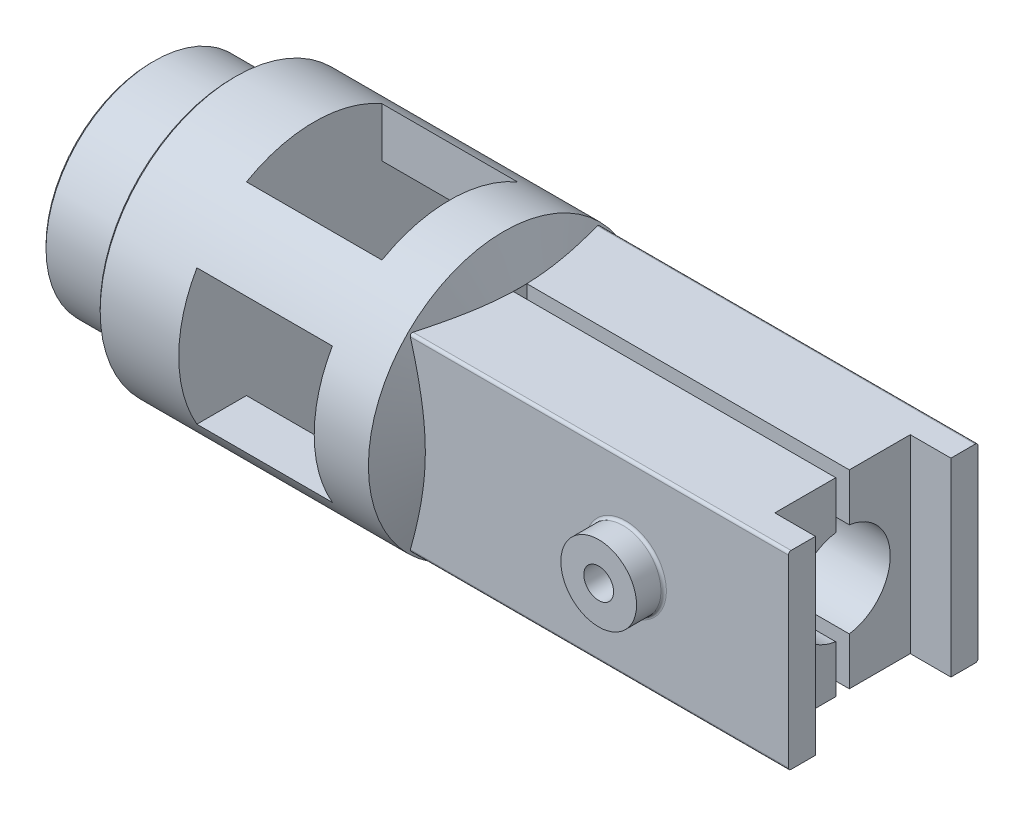
from build123d import *

# Parameters (mm, degrees)
SKETCH_1_W          = 3
SKETCH_1_H          = 4
SKETCH_2_W          = 8.891252249
SKETCH_2_H          = 5
SKETCH_2_W_2        = 5
SKETCH_2_H_2        = 11.708042321
CUT_EXTRUDE_1_DEPTH = 5
EXTRUDE_1_REACH     = 29.911
SKETCH_3_W          = 7
SKETCH_3_H          = 7
SKETCH_4_W          = 5
SKETCH_4_H          = 7
CUT_EXTRUDE_2_DEPTH = 1.5
SKETCH_5_R          = 1.761378247
SKETCH_5_W          = 0.5
SKETCH_5_H          = 7
CUT_EXTRUDE_3_DEPTH = 11.9
SKETCH_6_R          = 1.396648932
EXTRUDE_2_DEPTH     = 1
SKETCH_7_R          = 0.55
CUT_EXTRUDE_4_DEPTH = 30.055980452
CHAMFER_1_SIZE      = 0.5
FILLET_1_R          = 0.1
CHAMFER_2_SIZE      = 0.1
FILLET_2_R          = 0.1
SKETCH_8_R          = 2
CUT_EXTRUDE_5_DEPTH = 5
CHAMFER_3_SIZE      = 0.5


with BuildPart() as part:
    # 草图1 → 旋转1 (revolve)
    with BuildSketch(Plane.XY, mode=Mode.PRIVATE) as revolve_1_sk:
        with Locations((1.5, 2)):
            Rectangle(SKETCH_1_W, SKETCH_1_H)
        Polygon((3, 0), (13, 0), (13, 5), (3, 5), (3, 4), align=None)
        Polygon((13, 0), (13, 5), (15, 0), align=None)
    revolve(revolve_1_sk.sketch.rotate(Axis((3, 0, 0), (1, 0, 0)), 90), axis=Axis((3, 0, 0), (1, 0, 0)))

    # 草图2 → 切除-拉伸1 (cut)
    with BuildSketch(Plane.ZY.offset(-6)):
        with Locations((6.945626125, 0)):
            Rectangle(SKETCH_2_W, SKETCH_2_H)
        with Locations((0, -8.354021161)):
            Rectangle(SKETCH_2_W_2, SKETCH_2_H_2)
        with Locations((0, 8.354021161)):
            Rectangle(SKETCH_2_W_2, SKETCH_2_H_2)
        with Locations((-6.945626125, 0)):
            Rectangle(SKETCH_2_W, SKETCH_2_H)
        Rectangle(SKETCH_2_W_2, SKETCH_2_H)
    extrude(amount=-CUT_EXTRUDE_1_DEPTH, mode=Mode.SUBTRACT)

    # 凸台-拉伸1: up to this cone (the profile starts outside it)
    extrude_1_end = Plane(origin=(27, 0, 0), z_dir=(-1, 0, 0)).offset(12.000001) * Cone(2.5e-06, 46.0275, 18.410999, align=(Align.CENTER, Align.CENTER, Align.MIN), mode=Mode.PRIVATE)
    # 草图3 → 凸台-拉伸1 (add, up to the surface)
    with BuildSketch(Plane.ZY.offset(-27), mode=Mode.PRIVATE) as extrude_1_sk1:
        Rectangle(SKETCH_3_W, SKETCH_3_H)
    extrude_1_tool1 = extrude(extrude_1_sk1.sketch, amount=EXTRUDE_1_REACH, mode=Mode.PRIVATE) - extrude_1_end
    add(extrude_1_tool1.solids().sort_by_distance((27, 0, 0))[0])

    # 草图4 → 切除-拉伸2 (cut)
    with BuildSketch(Plane(origin=(27, 0, 0), x_dir=(0, 0, -1), z_dir=(1, 0, 0))):
        Rectangle(SKETCH_4_W, SKETCH_4_H)
    extrude(amount=-CUT_EXTRUDE_2_DEPTH, mode=Mode.SUBTRACT)

    # 草图5 → 切除-拉伸3 (cut)
    with BuildSketch(Plane(origin=(25.5, 0, 0), x_dir=(0, 0, -1), z_dir=(1, 0, 0))):
        Circle(SKETCH_5_R)
        Rectangle(SKETCH_5_W, SKETCH_5_H)
    extrude(amount=-CUT_EXTRUDE_3_DEPTH, mode=Mode.SUBTRACT)

    # 草图6 → 凸台-拉伸2 (add)
    with BuildSketch(Plane.XY.offset(3.5)):
        with Locations(Location((21, 0, 0), (0, 0, 180))):
            Circle(SKETCH_6_R)
    extrude(amount=EXTRUDE_2_DEPTH)

    # 草图7 → 切除-拉伸4 (cut, through all)
    with BuildSketch(Plane.XY.offset(4.5)):
        with Locations((21, 0)):
            Circle(SKETCH_7_R)
    extrude(amount=-CUT_EXTRUDE_4_DEPTH, mode=Mode.SUBTRACT)

    # 倒角1
    chamfer_1_edges = [part.edges().sort_by_distance(p)[0] for p in [
        (20.45, 0, -3.5),
    ]]
    chamfer(chamfer_1_edges, length=CHAMFER_1_SIZE)

    # 圆角1
    fillet_1_edges = [part.edges().sort_by_distance(p)[0] for p in [
        (22.396648932, 0, 3.5),
    ]]
    fillet(fillet_1_edges, radius=FILLET_1_R)

    # 倒角2
    chamfer_2_edges = [part.edges().sort_by_distance(p)[0] for p in [
        (0, 0, -4),
        (3, 0, -5),
    ]]
    chamfer(chamfer_2_edges, length=CHAMFER_2_SIZE)

    # 圆角2
    fillet_2_edges = [part.edges().sort_by_distance(p)[0] for p in [
        (20.010050506, -3.5, -3.5),
        (20.010050506, 3.5, -3.5),
        (20.010050506, 3.5, 3.5),
        (20.010050506, -3.5, 3.5),
    ]]
    fillet(fillet_2_edges, radius=FILLET_2_R)

    # 草图8 → 切除-拉伸5 (cut)
    with BuildSketch(Plane.ZY):
        Circle(SKETCH_8_R)
    extrude(amount=-CUT_EXTRUDE_5_DEPTH, mode=Mode.SUBTRACT)

    # 倒角3
    chamfer_3_edges = [part.edges().sort_by_distance(p)[0] for p in [
        (0, 0, -2),
    ]]
    chamfer(chamfer_3_edges, length=CHAMFER_3_SIZE)


solid = part.part
